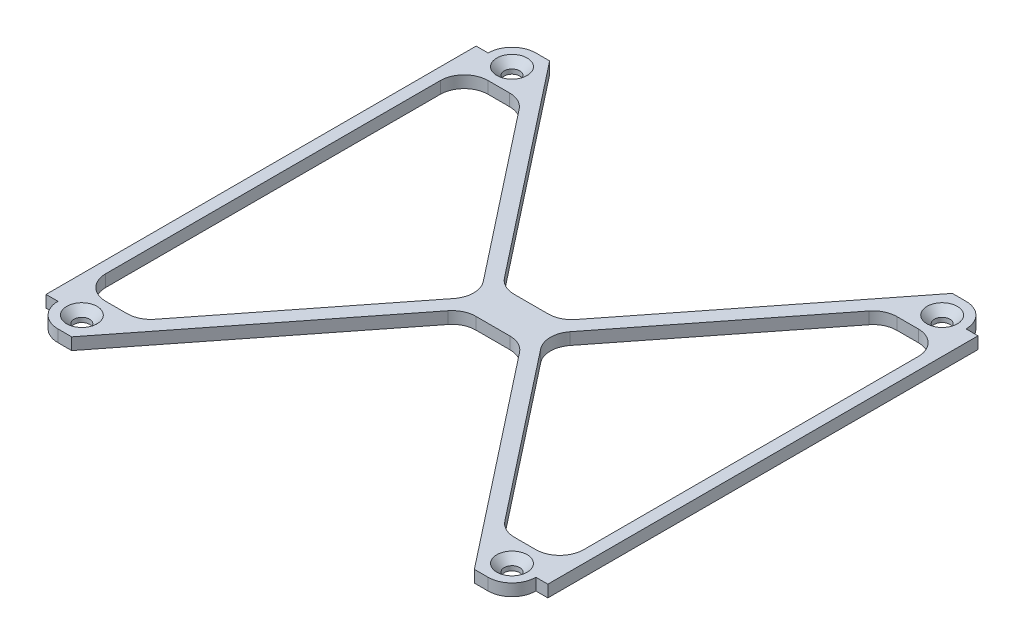
from build123d import *

# Parameters (mm, degrees)
SKETCH1_R           = 1.625
BOSS_EXTRUDE1_DEPTH = 2.5
FILLET1_R           = 5
FILLET2_R           = 5
CHAMFER1_SIZE       = 1.55


with BuildPart() as part:
    # Sketch1 → Boss-Extrude1 (new body)
    with BuildSketch(Plane(origin=(0, 0, 0), x_dir=(1, 0, 0), z_dir=(0, 1, 0))):
        with BuildLine():
            Line((-52.5, 45), (-52.5, -45))
            Line((-52.5, -45), (-50, -45))
            ThreePointArc((-50, -45), (-48.535533906, -48.535533906), (-45, -50))
            Line((-45, -50), (-42.127158908, -50))
            Line((-42.127158908, -50), (-6, -4))
            Line((-6, -4), (6, -4))
            Line((6, -4), (42.127158908, -50))
            Line((42.127158908, -50), (45, -50))
            ThreePointArc((45, -50), (48.535533906, -48.535533906), (50, -45))
            Line((50, -45), (52.5, -45))
            Line((52.5, -45), (52.5, 45))
            Line((52.5, 45), (50, 45))
            ThreePointArc((50, 45), (48.535533906, 48.535533906), (45, 50))
            Line((45, 50), (42.127158908, 50))
            Line((42.127158908, 50), (6, 4))
            Line((6, 4), (-6, 4))
            Line((-6, 4), (-42.127158908, 50))
            Line((-42.127158908, 50), (-45, 50))
            ThreePointArc((-45, 50), (-48.535533906, 48.535533906), (-50, 45))
            Line((-50, 45), (-52.5, 45))
        make_face()
        with Locations(Location((-45, 45, 0), (0, 0, 270))):
            Circle(SKETCH1_R, mode=Mode.SUBTRACT)
        with Locations(Location((45, 45, 0), (0, 0, 270))):
            Circle(SKETCH1_R, mode=Mode.SUBTRACT)
        with Locations(Location((-45, -45, 0), (0, 0, 270))):
            Circle(SKETCH1_R, mode=Mode.SUBTRACT)
        with Locations(Location((45, -45, 0), (0, 0, 270))):
            Circle(SKETCH1_R, mode=Mode.SUBTRACT)
        Polygon((-50, 40), (-50, -40), (-38.088044946, -40), (-6.673124156, 0), (-38.088044946, 40), align=None, mode=Mode.SUBTRACT)
        Polygon((50, -40), (38.088044946, -40), (6.673124156, 0), (38.088044946, 40), (50, 40), align=None, mode=Mode.SUBTRACT)
    extrude(amount=BOSS_EXTRUDE1_DEPTH)

    # Fillet1
    fillet1_edges = [part.edges().sort_by_distance(p)[0] for p in [
        (-6, 1.25, -4),
        (6, 1.25, -4),
        (6, 1.25, 4),
        (-6, 1.25, 4),
        (-6.673124156, 1.25, 0),
        (6.673124156, 1.25, 0),
    ]]
    fillet(fillet1_edges, radius=FILLET1_R)

    # Fillet2
    fillet2_edges = [part.edges().sort_by_distance(p)[0] for p in [
        (-38.088044946, 1.25, -40),
        (-50, 1.25, -40),
        (-50, 1.25, 40),
        (-38.088044946, 1.25, 40),
        (50, 1.25, 40),
        (50, 1.25, -40),
        (38.088044946, 1.25, -40),
        (38.088044946, 1.25, 40),
    ]]
    fillet(fillet2_edges, radius=FILLET2_R)

    # Chamfer1
    chamfer1_edges = [part.edges().sort_by_distance(p)[0] for p in [
        (-45, 2.5, -46.625),
        (45, 2.5, -46.625),
        (-45, 2.5, 43.375),
        (45, 2.5, 43.375),
    ]]
    chamfer(chamfer1_edges, length=CHAMFER1_SIZE)


solid = part.part
